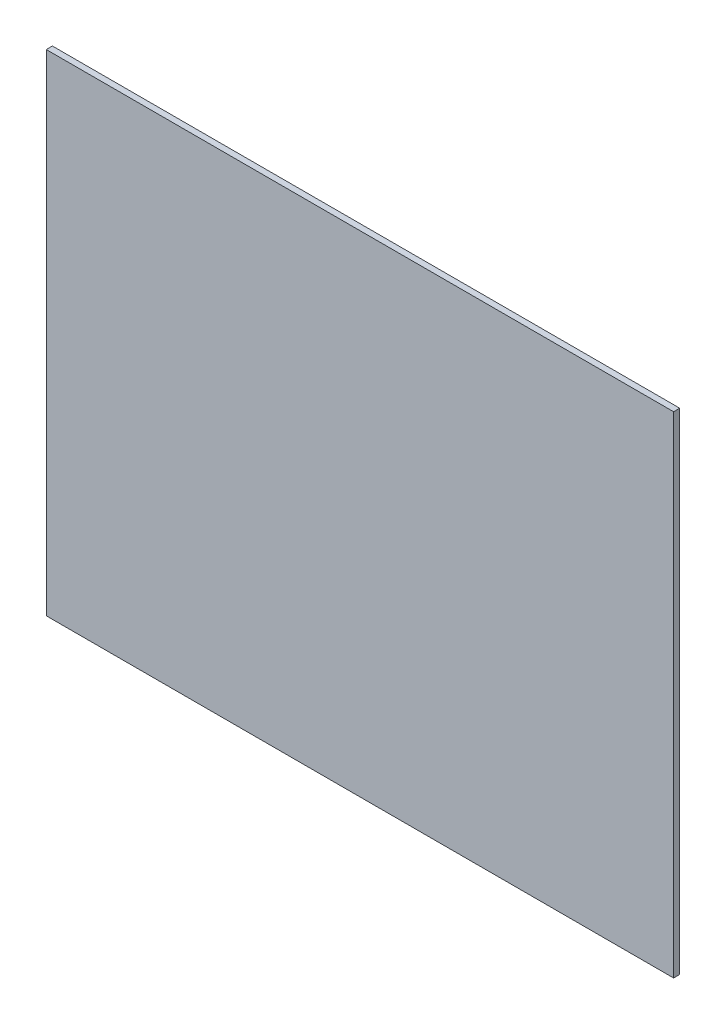
from build123d import *

# Parameters (mm, degrees)
SKETCH1_W           = 700
SKETCH1_H           = 588
BOSS_EXTRUDE1_DEPTH = 6
FILLET1_R           = 20
SKETCH3_W           = 831.612655864
SKETCH3_H           = 634.364017828
SKETCH3_W_2         = 614
SKETCH3_H_2         = 480
CUT_EXTRUDE2_DEPTH  = 10


with BuildPart() as part:
    # Sketch1 → Boss-Extrude1 (new body)
    with BuildSketch(Plane.XY):
        Rectangle(SKETCH1_W, SKETCH1_H)
    extrude(amount=BOSS_EXTRUDE1_DEPTH)

    # Fillet1
    fillet1_edges = [part.edges().sort_by_distance(p)[0] for p in [
        (350, -294, 3),
        (-350, -294, 3),
        (-350, 294, 3),
        (350, 294, 3),
    ]]
    fillet(fillet1_edges, radius=FILLET1_R)

    # Sketch3 → Cut-Extrude2 (cut)
    with BuildSketch(Plane(origin=(0, 0, 0), x_dir=(-1, 0, 0), z_dir=(0, 0, -1))):
        with Locations((-20, 0)):
            Rectangle(SKETCH3_W, SKETCH3_H)
        with Locations((-20, 0)):
            Rectangle(SKETCH3_W_2, SKETCH3_H_2, mode=Mode.SUBTRACT)
    extrude(amount=-CUT_EXTRUDE2_DEPTH, mode=Mode.SUBTRACT)


solid = part.part
